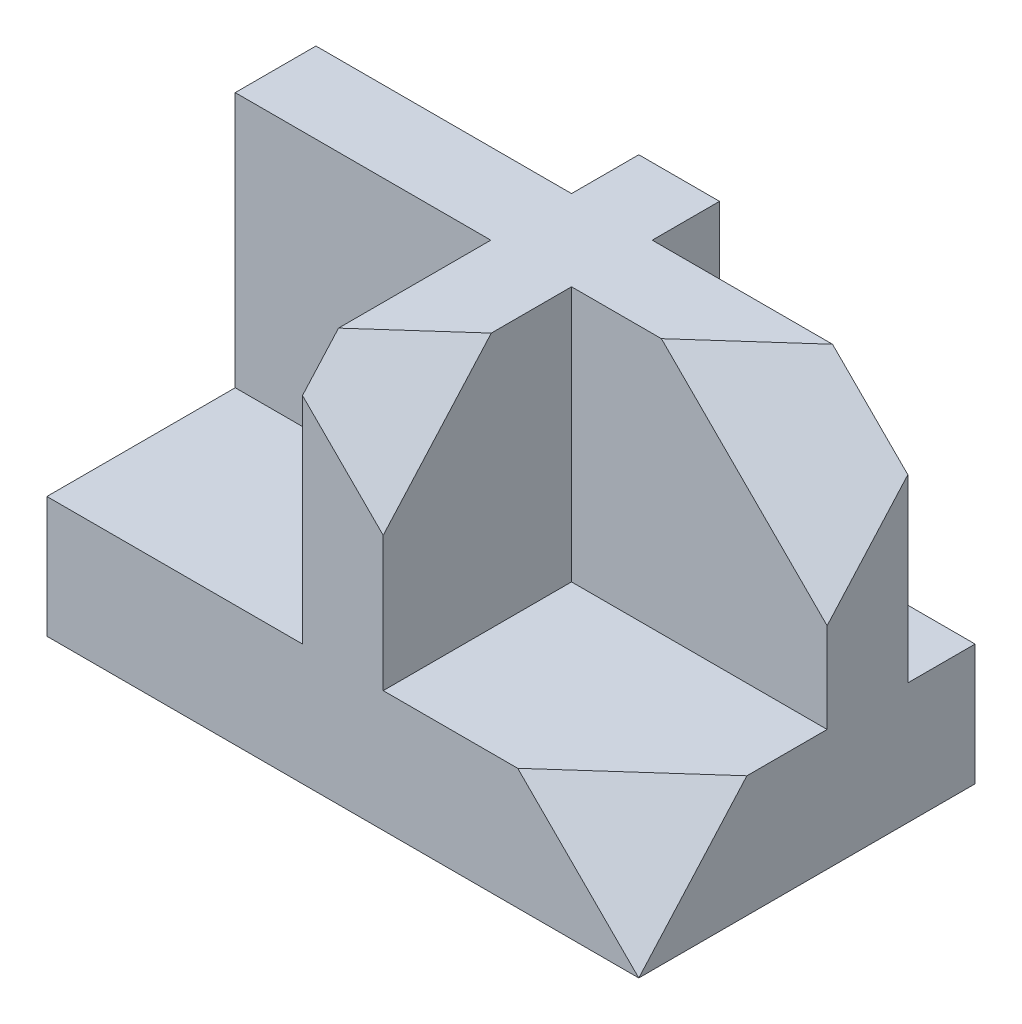
from build123d import *

# Parameters (mm, degrees)
SKETCH1_W           = 88
SKETCH1_H           = 50
BOSS_EXTRUDE1_DEPTH = 18
BOSS_EXTRUDE2_DEPTH = 38
CUT_EXTRUDE1_DEPTH  = 90.430894862


with BuildPart() as part:
    # Sketch1 → Boss-Extrude1 (new body)
    with BuildSketch(Plane(origin=(0, 0, 0), x_dir=(1, 0, 0), z_dir=(0, 1, 0))):
        Rectangle(SKETCH1_W, SKETCH1_H)
    extrude(amount=BOSS_EXTRUDE1_DEPTH)

    # Sketch2 → Boss-Extrude2 (add)
    with BuildSketch(Plane(origin=(0, 18, 0), x_dir=(1, 0, 0), z_dir=(0, 1, 0))):
        Polygon((-44, 15), (-6, 15), (-6, 25), (6, 25), (6, 15), (44, 15), (44, 3), (6, 3), (6, -25), (-6, -25), (-6, 3), (-44, 3), align=None)
    extrude(amount=BOSS_EXTRUDE2_DEPTH)

    # Sketch11 → Cut-Extrude1 (cut, through all)
    with BuildSketch(Plane(origin=(22.123893805, 22.123893805, 24.778761062), x_dir=(0.8323002445923471, -0.3691892497304549, -0.4134919596981095), z_dir=(0.5543250876981117, 0.5543250876981182, 0.6208440982218921))):
        Polygon((-40.999499912, 25.122114818), (26.28391177, 58.422903284), (26.28391177, -16.650394233), align=None)
    extrude(amount=CUT_EXTRUDE1_DEPTH, mode=Mode.SUBTRACT)


solid = part.part
